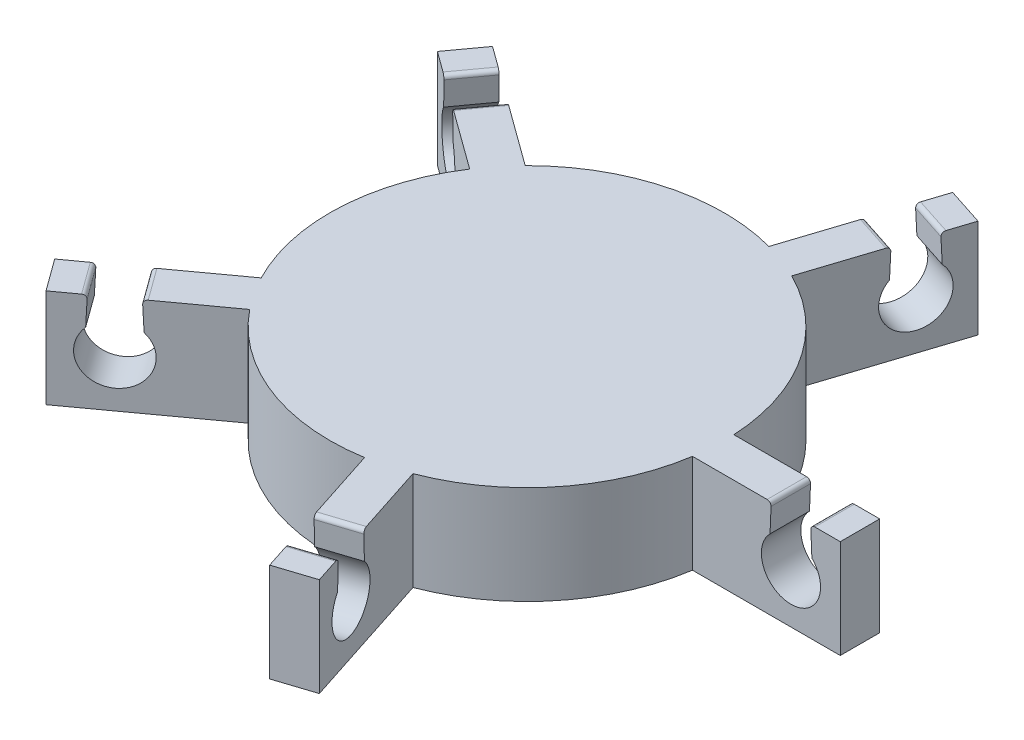
from build123d import *

# Parameters (mm, degrees)
ESQUISSE1_R               = 10
BASE_DEPTH                = 5
BOSS_BALEINE_DEPTH        = 5
VIDE_BALEINE_DEPTH        = 3
REP_SUPPORT_BALEINE_COUNT = 5
CONGE_BALEINE_R           = 0.2


with BuildPart() as part:
    # Esquisse1 → BASE (new body)
    with BuildSketch(Plane(origin=(0, 0, 0), x_dir=(1, 0, 0), z_dir=(0, 1, 0))):
        with Locations(Location((0, 0, 0), (0, 0, 270))):
            Circle(ESQUISSE1_R)
    extrude(amount=-BASE_DEPTH)

    # Esquisse2 → BOSS - BALEINE (add)
    with BuildSketch(Plane(origin=(0, 0, 0), x_dir=(1, 0, 0), z_dir=(0, 1, 0))):
        with BuildLine():
            ThreePointArc((9.38083152, -1.5), (9.486684928, -0.502801231), (9.486832981, 0.5))
            Line((9.486832981, 0.5), (17.38083152, 0.5))
            Line((17.38083152, 0.5), (17.38083152, -1.5))
            Line((17.38083152, -1.5), (9.38083152, -1.5))
        make_face()
    boss_baleine = extrude(amount=-BOSS_BALEINE_DEPTH)

    # Esquisse3 → VIDE - BALEINE (cut)
    with BuildSketch(Plane.XY.offset(1.5)):
        with BuildLine():
            Line((13.88083152, 0), (13.820171348, -1.439339828))
            ThreePointArc((13.820171348, -1.439339828), (14.88083152, -4), (15.941491691, -1.439339828))
            Line((15.941491691, -1.439339828), (15.88083152, 0))
            Line((15.88083152, 0), (13.88083152, 0))
        make_face()
    vide_baleine = extrude(amount=-VIDE_BALEINE_DEPTH, mode=Mode.SUBTRACT)

    # REP - SUPPORT BALEINE: BOSS - BALEINE, VIDE - BALEINE ×5 about axis
    rep_support_baleine_axis = Axis((0, 0, 0), (0, 1, 0))
    add([boss_baleine.rotate(rep_support_baleine_axis, i * 360 / REP_SUPPORT_BALEINE_COUNT) for i in range(1, REP_SUPPORT_BALEINE_COUNT)])
    add([vide_baleine.rotate(rep_support_baleine_axis, i * 360 / REP_SUPPORT_BALEINE_COUNT) for i in range(1, REP_SUPPORT_BALEINE_COUNT)], mode=Mode.SUBTRACT)

    # CONGE BALEINE
    conge_baleine_edges = [part.edges().sort_by_distance(p)[0] for p in [
        (4.764941094, 0, -13.046946771),
        (5.382975083, 0, -14.949059804),
        (-10.935935969, 0, -8.563456554),
        (-12.553969958, 0, -9.739027059),
        (-11.523721222, 0, 7.75443956),
        (-13.14175521, 0, 8.930010064),
        (3.813884577, 0, 13.355963766),
        (4.431918566, 0, 15.258076798),
        (13.88083152, 0, 0.5),
        (15.88083152, 0, 0.5),
    ]]
    fillet(conge_baleine_edges, radius=CONGE_BALEINE_R)


solid = part.part
